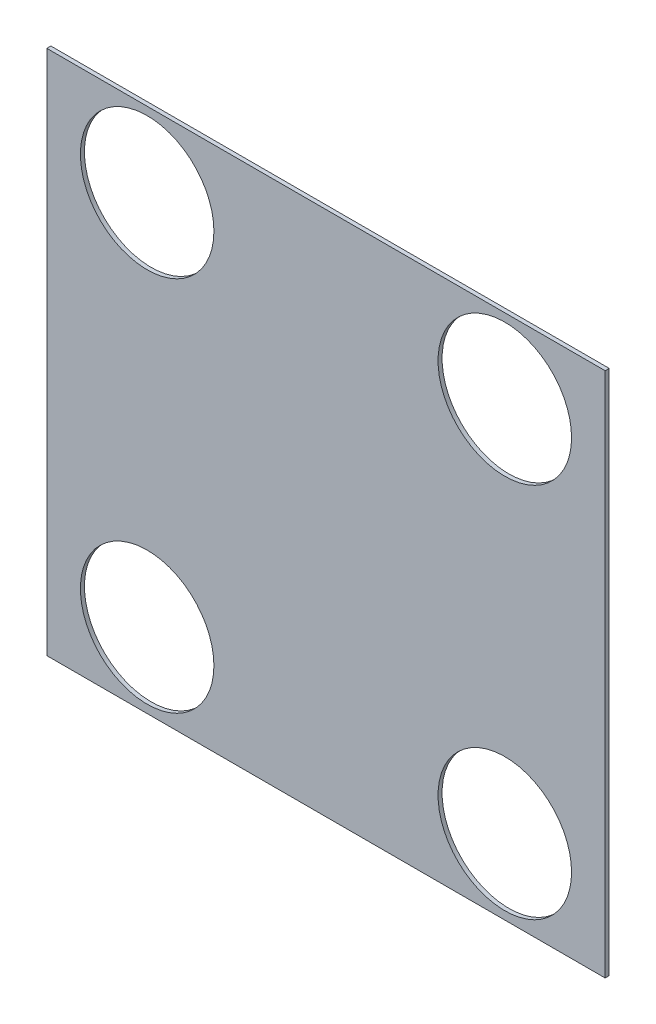
from build123d import *

# Parameters (mm, degrees)
SKETCH_1_W           = 690
SKETCH_1_H           = 650
BOTTOM_PLATE_DEPTH   = 5
SKETCH_2_R           = 82.5
GRAB_CLEARANCE_DEPTH = 948.958332418
SKETCH_3_R           = 82.5
CUT_EXTRUDE_2_DEPTH  = 948.958332418
SKETCH_4_R           = 82.5
CUT_EXTRUDE_3_DEPTH  = 948.958332418
SKETCH_5_R           = 82.5
CUT_EXTRUDE_4_DEPTH  = 948.958332418


with BuildPart() as part:
    # 草图1 → Bottom_plate (new body)
    with BuildSketch(Plane.XY):
        with Locations((345, 325)):
            Rectangle(SKETCH_1_W, SKETCH_1_H)
    extrude(amount=BOTTOM_PLATE_DEPTH)

    # 草图2 → Grab_clearance (cut, through all)
    with BuildSketch(Plane.XY.offset(5)):
        with Locations((124, 92.5)):
            Circle(SKETCH_2_R)
    extrude(amount=-GRAB_CLEARANCE_DEPTH, mode=Mode.SUBTRACT)

    # 草图3 → 切除-拉伸2 (cut, through all)
    with BuildSketch(Plane.XY.offset(5)):
        with Locations((124, 557.5)):
            Circle(SKETCH_3_R)
    extrude(amount=-CUT_EXTRUDE_2_DEPTH, mode=Mode.SUBTRACT)

    # 草图4 → 切除-拉伸3 (cut, through all)
    with BuildSketch(Plane.XY.offset(5)):
        with Locations((566, 92.5)):
            Circle(SKETCH_4_R)
    extrude(amount=-CUT_EXTRUDE_3_DEPTH, mode=Mode.SUBTRACT)

    # 草图5 → 切除-拉伸4 (cut, through all)
    with BuildSketch(Plane.XY.offset(5)):
        with Locations((566, 557.5)):
            Circle(SKETCH_5_R)
    extrude(amount=-CUT_EXTRUDE_4_DEPTH, mode=Mode.SUBTRACT)


solid = part.part
